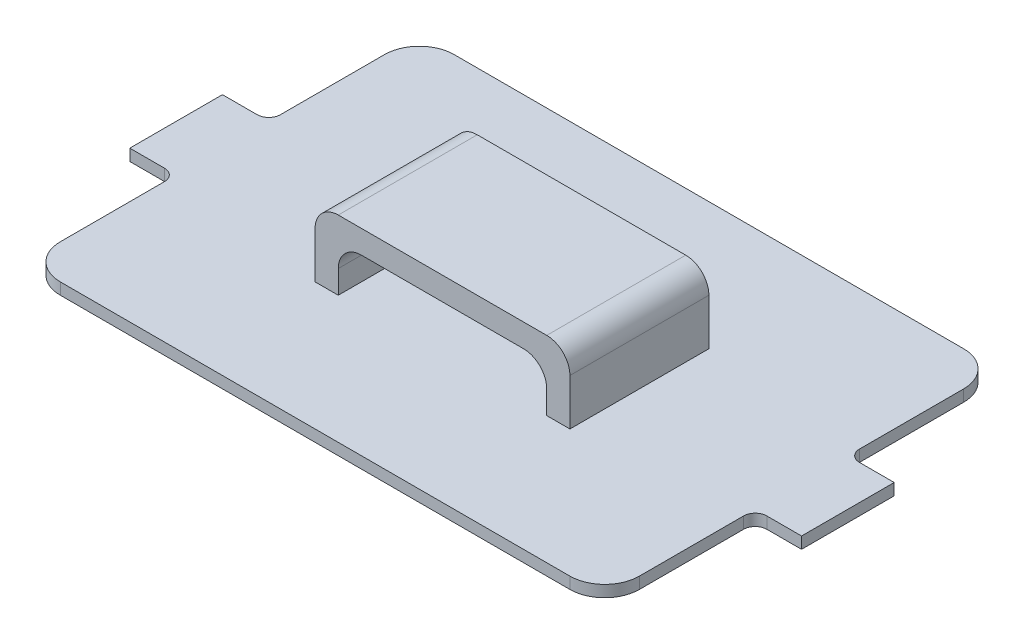
from build123d import *

# Parameters (mm, degrees)
SKETCH1_W           = 125
SKETCH1_H           = 85
BOSS_EXTRUDE1_DEPTH = 2.5
SKETCH2_W           = 10
SKETCH2_H           = 20
SKETCH2_H_2         = 10
BOSS_EXTRUDE2_DEPTH = 2.5
FILLET1_R           = 2.5
FILLET2_R           = 7.5
SKETCH3_W           = 5
SKETCH3_H           = 15
BOSS_EXTRUDE3_DEPTH = 15
BOSS_EXTRUDE4_REACH = 130.671
SKETCH4_W           = 30
SKETCH4_H           = 5
FILLET3_R           = 5


with BuildPart() as part:
    # Sketch1 → Boss-Extrude1 (new body)
    with BuildSketch(Plane(origin=(0, 0, 0), x_dir=(1, 0, 0), z_dir=(0, 1, 0))):
        with Locations((62.5, 42.5)):
            Rectangle(SKETCH1_W, SKETCH1_H)
    extrude(amount=BOSS_EXTRUDE1_DEPTH)

    # Sketch2 → Boss-Extrude2 (add)
    with BuildSketch(Plane(origin=(0, 2.5, 0), x_dir=(1, 0, 0), z_dir=(0, 1, 0))):
        with Locations((130, 42.5)):
            Rectangle(SKETCH2_W, SKETCH2_H)
        with Locations((-5, 37.5)):
            Rectangle(SKETCH2_W, SKETCH2_H_2)
        with Locations((-5, 47.5)):
            Rectangle(SKETCH2_W, SKETCH2_H_2)
    extrude(amount=-BOSS_EXTRUDE2_DEPTH)

    # Fillet1
    fillet1_edges = [part.edges().sort_by_distance(p)[0] for p in [
        (125, 1.25, -32.5),
        (125, 1.25, -52.5),
        (0, 1.25, -32.5),
        (0, 1.25, -52.5),
    ]]
    fillet(fillet1_edges, radius=FILLET1_R)

    # Fillet2
    fillet2_edges = [part.edges().sort_by_distance(p)[0] for p in [
        (0, 1.25, -85),
        (125, 1.25, -85),
        (125, 1.25, 0),
        (0, 1.25, 0),
    ]]
    fillet(fillet2_edges, radius=FILLET2_R)

    # Sketch3 → Boss-Extrude3 (add)
    with BuildSketch(Plane(origin=(0, 2.5, 0), x_dir=(1, 0, 0), z_dir=(0, 1, 0))):
        with Locations((37.5, 50)):
            Rectangle(SKETCH3_W, SKETCH3_H)
        with Locations((37.5, 35)):
            Rectangle(SKETCH3_W, SKETCH3_H)
        with Locations((87.5, 50)):
            Rectangle(SKETCH3_W, SKETCH3_H)
        with Locations((87.5, 35)):
            Rectangle(SKETCH3_W, SKETCH3_H)
    extrude(amount=BOSS_EXTRUDE3_DEPTH)

    # Sketch4 → Boss-Extrude4 (add, up to next)
    with BuildSketch(Plane(origin=(40, 0, 0), x_dir=(0, 0, -1), z_dir=(1, 0, 0)), mode=Mode.PRIVATE) as boss_extrude4_sk1:
        with Locations((42.5, 15)):
            Rectangle(SKETCH4_W, SKETCH4_H)
    boss_extrude4_tool1 = extrude(boss_extrude4_sk1.sketch, amount=BOSS_EXTRUDE4_REACH, mode=Mode.PRIVATE) - part.part
    add(boss_extrude4_tool1.solids().sort_by_distance((40, 15, -42.5))[0])

    # Fillet3
    fillet3_edges = [part.edges().sort_by_distance(p)[0] for p in [
        (35, 17.5, -42.5),
        (90, 17.5, -42.5),
        (85, 12.5, -42.5),
        (40, 12.5, -42.5),
    ]]
    fillet(fillet3_edges, radius=FILLET3_R)


solid = part.part
